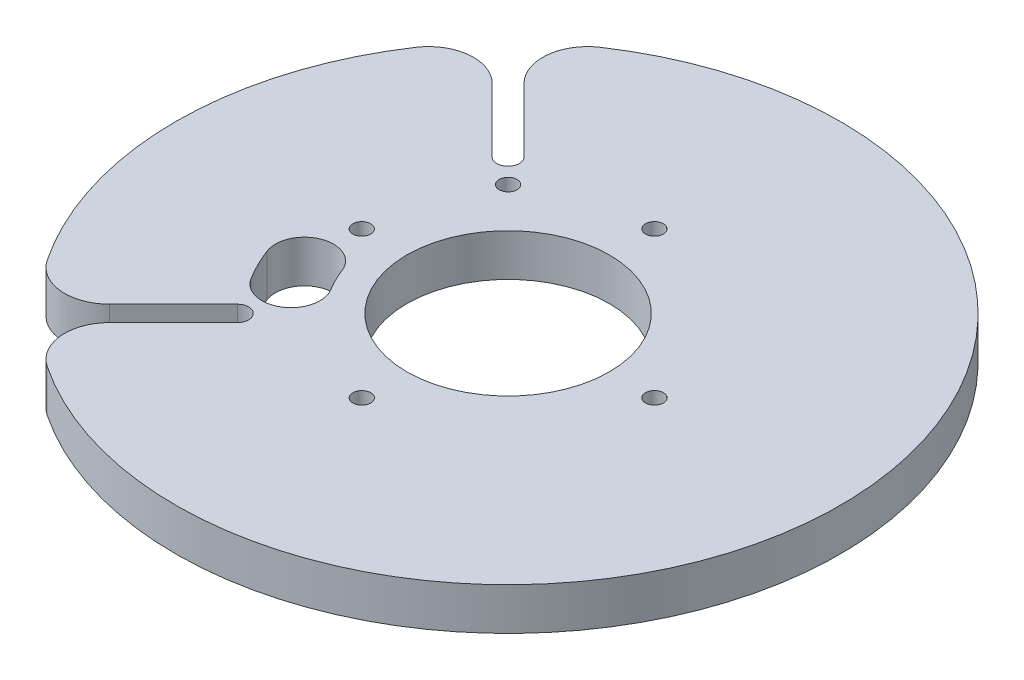
from build123d import *

# Parameters (mm, degrees)
SKETCH1_R           = 75
BOSS_EXTRUDE1_DEPTH = 9.525
CUT_EXTRUDE2_REACH  = 108.493
FILLET1_R           = 10.16
SKETCH39_R          = 22.86
SKETCH39_R_2        = 2.0193
CUT_EXTRUDE30_DEPTH = 247.31360274
SKETCH42_R          = 2.0193
CUT_EXTRUDE33_DEPTH = 247.31360274
CUT_EXTRUDE35_DEPTH = 247.31360274


with BuildPart() as part:
    # Sketch1 → Boss-Extrude1 (new body)
    with BuildSketch(Plane(origin=(0, 0, 0), x_dir=(1, 0, 0), z_dir=(0, 1, 0))):
        with Locations(Location((0, 0, 0), (0, 0, 90))):
            Circle(SKETCH1_R)
    extrude(amount=BOSS_EXTRUDE1_DEPTH)

    # Sketch11 → Cut-Extrude2 (cut, up to next)
    with BuildSketch(Plane(origin=(0, 9.525, 0), x_dir=(1, 0, 0), z_dir=(0, 1, 0)), mode=Mode.PRIVATE) as cut_extrude2_sk1:
        with BuildLine():
            Line((-54.798637954, 51.206535505), (-32.347997651, 28.755895202))
            ThreePointArc((-32.347997651, 28.755895202), (-28.755895202, 28.755895202), (-28.755895202, 32.347997651))
            Line((-28.755895202, 32.347997651), (-51.206535505, 54.798637954))
            ThreePointArc((-51.206535505, 54.798637954), (-53.033008589, 53.033008589), (-54.798637954, 51.206535505))
        make_face()
    cut_extrude2_tool1 = extrude(cut_extrude2_sk1.sketch, amount=-CUT_EXTRUDE2_REACH, mode=Mode.PRIVATE) & part.part
    # Sketch11 → Cut-Extrude2 (cut, up to next)
    with BuildSketch(Plane(origin=(0, 9.525, 0), x_dir=(1, 0, 0), z_dir=(0, 1, 0)), mode=Mode.PRIVATE) as cut_extrude2_sk2:
        with BuildLine():
            Line((-51.206535505, -54.798637954), (-28.755895202, -32.347997651))
            ThreePointArc((-28.755895202, -32.347997651), (-28.755895202, -28.755895202), (-32.347997651, -28.755895202))
            Line((-32.347997651, -28.755895202), (-54.798637954, -51.206535505))
            ThreePointArc((-54.798637954, -51.206535505), (-53.033008589, -53.033008589), (-51.206535505, -54.798637954))
        make_face()
    cut_extrude2_tool2 = extrude(cut_extrude2_sk2.sketch, amount=-CUT_EXTRUDE2_REACH, mode=Mode.PRIVATE) & part.part
    add(cut_extrude2_tool1.solids().sort_by_distance((-41.078737, 9.525, -41.078737))[0], mode=Mode.SUBTRACT)
    add(cut_extrude2_tool2.solids().sort_by_distance((-41.078737, 9.525, 41.078737))[0], mode=Mode.SUBTRACT)

    # Fillet1
    fillet1_edges = [part.edges().sort_by_distance(p)[0] for p in [
        (-51.206535505, 4.7625, 54.798637954),
        (-54.798637954, 4.7625, 51.206535505),
        (-54.798637954, 4.7625, -51.206535505),
        (-51.206535505, 4.7625, -54.798637954),
    ]]
    fillet(fillet1_edges, radius=FILLET1_R)

    # Sketch39 → Cut-Extrude30 (cut, through all)
    with BuildSketch(Plane(origin=(-73.768816189, 9.525, -121.080352405), x_dir=(1, 0, 0), z_dir=(0, 1, 0))):
        with Locations(Location((73.768816189, -121.080352405, 0), (0, 0, 270))):
            Circle(SKETCH39_R)
        with Locations(Location((73.768816189, -88.060352405, 0), (0, 0, 270))):
            Circle(SKETCH39_R_2)
        with Locations(Location((106.788816189, -121.080352405, 0), (0, 0, 270))):
            Circle(SKETCH39_R_2)
        with Locations(Location((73.768816189, -154.100352405, 0), (0, 0, 270))):
            Circle(SKETCH39_R_2)
        with Locations(Location((40.748816189, -121.080352405, 0), (0, 0, 270))):
            Circle(SKETCH39_R_2)
    extrude(amount=-CUT_EXTRUDE30_DEPTH, mode=Mode.SUBTRACT)

    # Sketch42 → Cut-Extrude33 (cut, through all)
    with BuildSketch(Plane(origin=(-73.768816189, 9.525, -121.080352405), x_dir=(1, 0, 0), z_dir=(0, 1, 0))):
        with Locations(Location((48.605023435, -95.916559651, 0), (0, 0, 270))):
            Circle(SKETCH42_R)
    extrude(amount=-CUT_EXTRUDE33_DEPTH, mode=Mode.SUBTRACT)

    # Sketch44 → Cut-Extrude35 (cut, through all)
    with BuildSketch(Plane(origin=(-73.768816189, 9.525, -121.080352405), x_dir=(1, 0, 0), z_dir=(0, 1, 0))):
        with BuildLine():
            ThreePointArc((34.405967979, -136.122213123), (36.00963526, -139.786919397), (37.953573181, -143.283049568))
            ThreePointArc((37.953573181, -143.283049568), (46.974494303, -145.399596657), (49.091041391, -136.378675534))
            ThreePointArc((49.091041391, -136.378675534), (47.751609959, -133.969737166), (46.646635186, -131.444644817))
            ThreePointArc((46.646635186, -131.444644817), (38.18751743, -127.663095366), (34.405967979, -136.122213123))
        make_face()
    extrude(amount=-CUT_EXTRUDE35_DEPTH, mode=Mode.SUBTRACT)


solid = part.part
